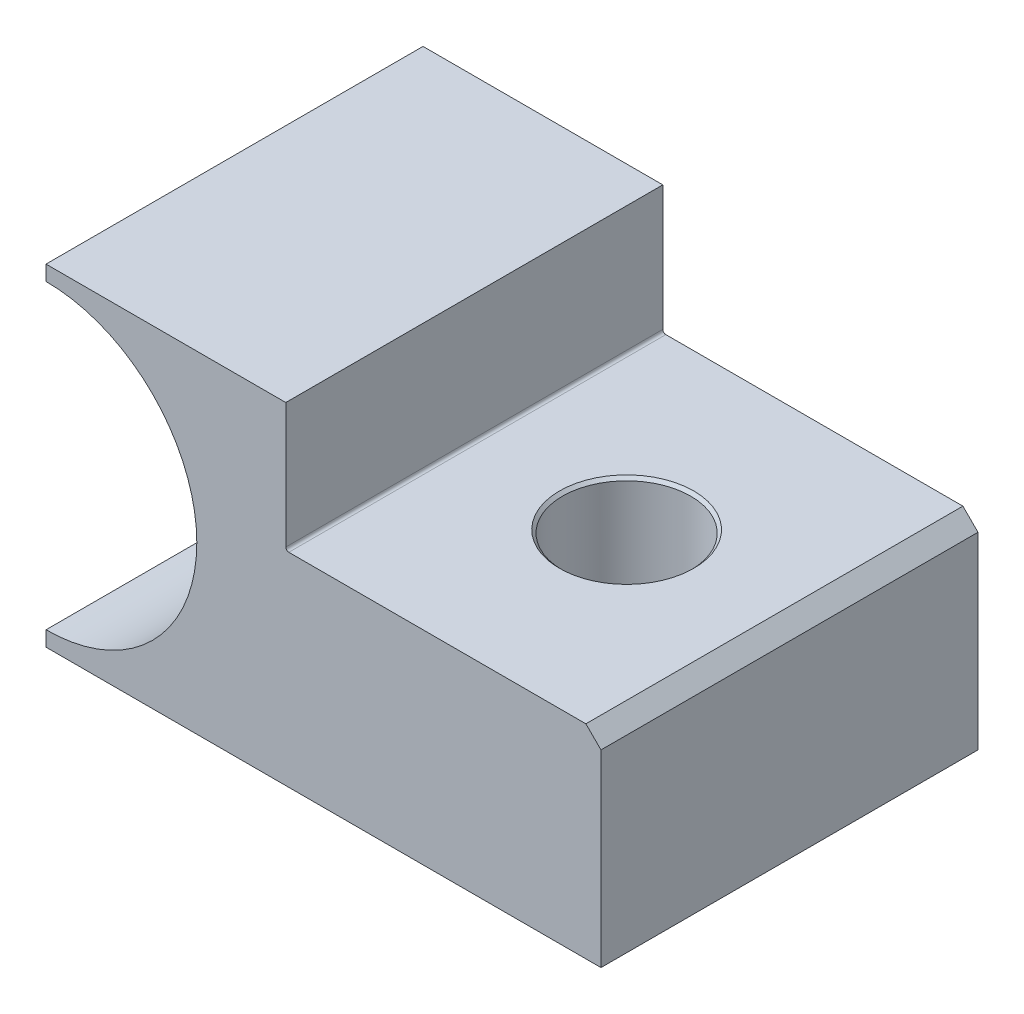
from build123d import *

# Parameters (mm, degrees)
BOSS_EXTRUDE1_DEPTH      = 31.75
X_0_397_DIAMETER_HOLE1_D = 10.795
CHAMFER1_SIZE            = 1.27
CHAMFER2_SIZE            = 0.254
FILLET1_R                = 0.254


with BuildPart() as part:
    # Sketch1 → Boss-Extrude1 (new body)
    with BuildSketch(Plane.XY):
        with BuildLine():
            Line((46.736, 0), (46.736, 17.145))
            Line((46.736, 17.145), (20.193, 17.145))
            Line((20.193, 17.145), (20.193, 27.94))
            Line((20.193, 27.94), (0, 27.94))
            Line((0, 27.94), (0, 26.67))
            ThreePointArc((0, 26.67), (12.7, 13.97), (0, 1.27))
            Line((0, 1.27), (0, 0))
            Line((0, 0), (46.736, 0))
        make_face()
    extrude(amount=BOSS_EXTRUDE1_DEPTH)

    # X (0.397) Diameter Hole1 (through all)
    with Locations(Plane(origin=(0, 17.145, 0), x_dir=(1, 0, 0), z_dir=(0, 1, 0))):
        with Locations((33.02, -15.875)):
            Hole(X_0_397_DIAMETER_HOLE1_D / 2)

    # Chamfer1
    chamfer1_edges = [part.edges().sort_by_distance(p)[0] for p in [
        (46.736, 17.145, 15.875),
    ]]
    chamfer(chamfer1_edges, length=CHAMFER1_SIZE)

    # Chamfer2
    chamfer2_edges = [part.edges().sort_by_distance(p)[0] for p in [
        (38.4175, 17.145, 15.875),
    ]]
    chamfer(chamfer2_edges, length=CHAMFER2_SIZE)

    # Fillet1
    fillet1_edges = [part.edges().sort_by_distance(p)[0] for p in [
        (20.193, 17.145, 15.875),
    ]]
    fillet(fillet1_edges, radius=FILLET1_R)


solid = part.part
